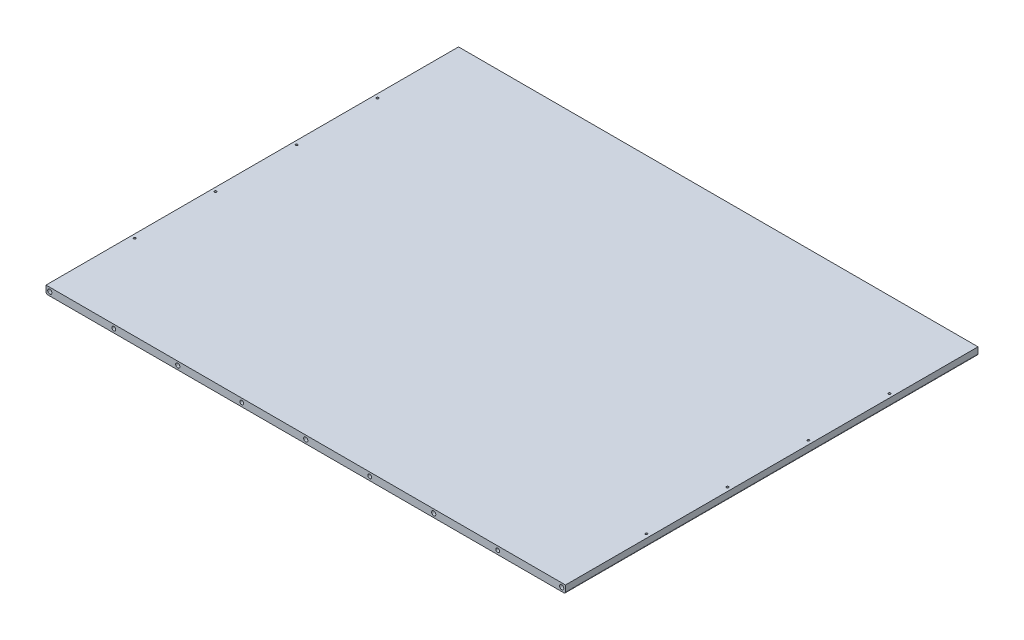
from build123d import *

# Parameters (mm, degrees)
SKETCH1_W           = 863.6
SKETCH1_H           = 685.8
BOSS_EXTRUDE1_DEPTH = 12.7
FILLET1_R           = 2.54
SKETCH6_R           = 1.7526
CUT_EXTRUDE5_DEPTH  = 552.536889065
SKETCH8_R           = 6
CUT_EXTRUDE7_DEPTH  = 9.850000112
SKETCH9_R           = 3.499999985
CUT_EXTRUDE8_DEPTH  = 34
SKETCH10_R          = 3.175
CUT_EXTRUDE9_DEPTH  = 26.67
SKETCH11_R          = 1.7526
CUT_EXTRUDE10_DEPTH = 11.43


with BuildPart() as part:
    # Sketch1 → Boss-Extrude1 (new body)
    with BuildSketch(Plane(origin=(0, 0, 0), x_dir=(1, 0, 0), z_dir=(0, 1, 0))):
        Rectangle(SKETCH1_W, SKETCH1_H)
    extrude(amount=BOSS_EXTRUDE1_DEPTH)

    # Fillet1
    fillet1_edges = [part.edges().sort_by_distance(p)[0] for p in [
        (-431.8, 0, 0),
        (431.8, 0, 0),
    ]]
    fillet(fillet1_edges, radius=FILLET1_R)

    # Sketch6 → Cut-Extrude5 (cut, through all)
    with BuildSketch(Plane(origin=(0, 12.7, 0), x_dir=(1, 0, 0), z_dir=(0, 1, 0))):
        with Locations(Location((-425.45, 201.93, 0), (0, 0, 270))):
            Circle(SKETCH6_R)
        with Locations(Location((-425.45, 67.31, 0), (0, 0, 270))):
            Circle(SKETCH6_R)
        with Locations(Location((-425.45, -67.31, 0), (0, 0, 270))):
            Circle(SKETCH6_R)
        with Locations(Location((-425.45, -201.93, 0), (0, 0, 270))):
            Circle(SKETCH6_R)
        with Locations(Location((425.45, -201.93, 0), (0, 0, 90))):
            Circle(SKETCH6_R)
        with Locations(Location((425.45, -67.31, 0), (0, 0, 90))):
            Circle(SKETCH6_R)
        with Locations(Location((425.45, 67.31, 0), (0, 0, 90))):
            Circle(SKETCH6_R)
        with Locations(Location((425.45, 201.93, 0), (0, 0, 90))):
            Circle(SKETCH6_R)
    extrude(amount=-CUT_EXTRUDE5_DEPTH, mode=Mode.SUBTRACT)

    # Sketch8 → Cut-Extrude7 (cut)
    with BuildSketch(Plane.XZ):
        with Locations(Location((-425.45, 308.9, 0), (0, 0, 270))):
            Circle(SKETCH8_R)
        with Locations(Location((-212.725, 308.9, 0), (0, 0, 270))):
            Circle(SKETCH8_R)
        with Locations(Location((0, 308.9, 0), (0, 0, 270))):
            Circle(SKETCH8_R)
        with Locations(Location((212.725, 308.9, 0), (0, 0, 270))):
            Circle(SKETCH8_R)
        with Locations(Location((425.45, 308.9, 0), (0, 0, 270))):
            Circle(SKETCH8_R)
    cut_extrude7 = extrude(amount=-CUT_EXTRUDE7_DEPTH, mode=Mode.SUBTRACT)

    # Sketch9 → Cut-Extrude8 (cut)
    with BuildSketch(Plane.XY.offset(342.9)):
        with Locations((-425.45, 6.35)):
            Circle(SKETCH9_R)
        with Locations((-212.725, 6.35)):
            Circle(SKETCH9_R)
        with Locations((0, 6.35)):
            Circle(SKETCH9_R)
        with Locations((212.725, 6.35)):
            Circle(SKETCH9_R)
        with Locations((425.45, 6.35)):
            Circle(SKETCH9_R)
    cut_extrude8 = extrude(amount=-CUT_EXTRUDE8_DEPTH, mode=Mode.SUBTRACT)

    # Sketch10 → Cut-Extrude9 (cut)
    with BuildSketch(Plane.XY.offset(342.9)):
        with Locations((-319.0875, 6.35)):
            Circle(SKETCH10_R)
        with Locations((-106.3625, 6.35)):
            Circle(SKETCH10_R)
        with Locations((106.3625, 6.35)):
            Circle(SKETCH10_R)
        with Locations((319.0875, 6.35)):
            Circle(SKETCH10_R)
    cut_extrude9 = extrude(amount=-CUT_EXTRUDE9_DEPTH, mode=Mode.SUBTRACT)

    # Mirror1: Cut-Extrude7, Cut-Extrude8, Cut-Extrude9 across plane
    add(cut_extrude7.mirror(Plane.XY), mode=Mode.SUBTRACT)
    add(cut_extrude8.mirror(Plane.XY), mode=Mode.SUBTRACT)
    add(cut_extrude9.mirror(Plane.XY), mode=Mode.SUBTRACT)

    # Sketch11 → Cut-Extrude10 (cut)
    with BuildSketch(Plane.XZ):
        with Locations(Location((-422.275, -255.415, 0), (0, 0, 270))):
            Circle(SKETCH11_R)
        with Locations(Location((422.275, -255.415, 0), (0, 0, 90))):
            Circle(SKETCH11_R)
        with Locations(Location((-422.275, 255.415, 0), (0, 0, 90))):
            Circle(SKETCH11_R)
        with Locations(Location((422.275, 255.415, 0), (0, 0, 270))):
            Circle(SKETCH11_R)
    extrude(amount=-CUT_EXTRUDE10_DEPTH, mode=Mode.SUBTRACT)


solid = part.part
